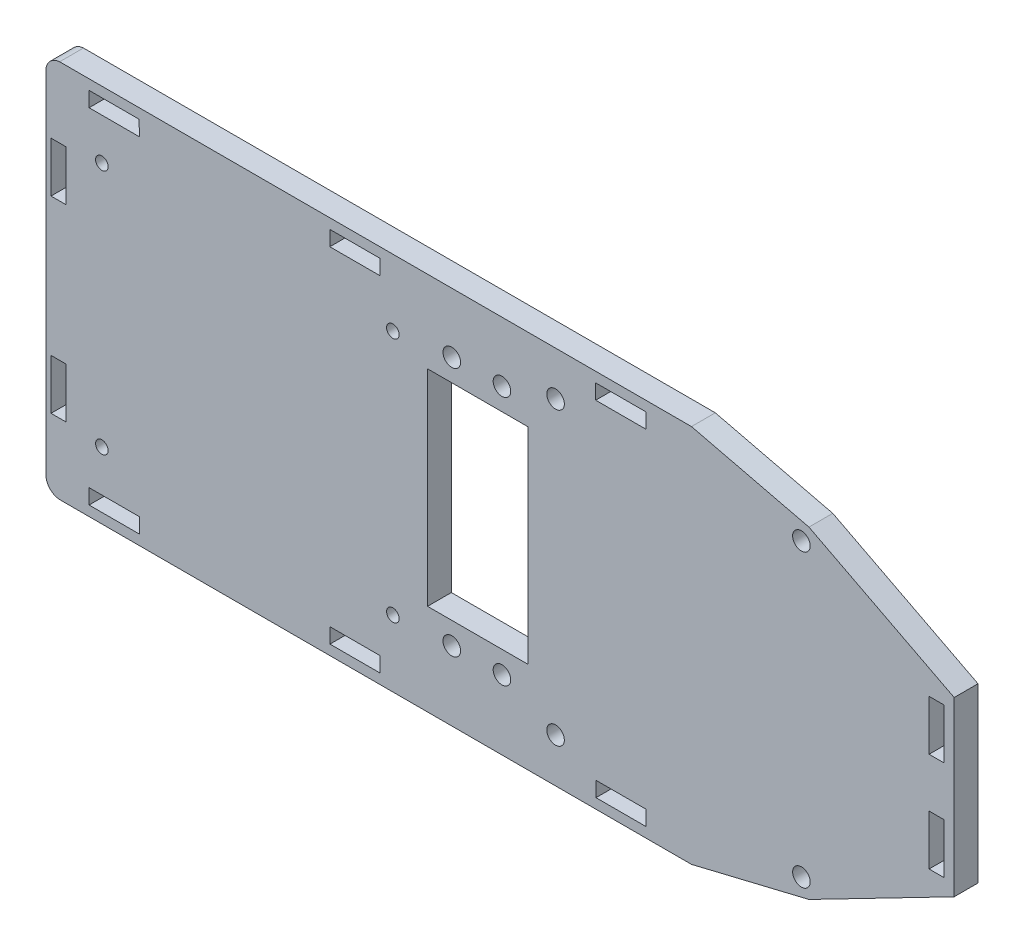
from build123d import *

# Parameters (mm, degrees)
SKETCH1_W           = 181
SKETCH1_H           = 75.57
BOSS_EXTRUDE2_DEPTH = 4.75
SKETCH6_W           = 3
SKETCH6_H           = 10
SKETCH6_W_2         = 10
SKETCH6_H_2         = 2.996296141
SKETCH6_W_3         = 9.939831887
SKETCH6_H_3         = 3
SKETCH6_W_4         = 20
SKETCH6_H_4         = 41
SKETCH6_R           = 1.75
SKETCH6_R_2         = 1.25
CUT_EXTRUDE7_DEPTH  = 9


with BuildPart() as part:
    # Sketch1 → Boss-Extrude2 (new body)
    with BuildSketch(Plane.XY):
        Rectangle(SKETCH1_W, SKETCH1_H)
    extrude(amount=BOSS_EXTRUDE2_DEPTH)

    # Sketch6 → Cut-Extrude7 (cut)
    with BuildSketch(Plane.XY.offset(4.75)):
        with BuildLine():
            Line((-90.5, 37.785), (-90.5, 35.274795088))
            ThreePointArc((-90.5, 35.274795088), (-89.587457665, 37.010103297), (-87.786468161, 37.785))
            Line((-87.786468161, 37.785), (-90.5, 37.785))
        make_face()
        with BuildLine():
            ThreePointArc((-87.786468161, -37.785), (-89.587457665, -37.010103297), (-90.5, -35.274795088))
            Line((-90.5, -35.274795088), (-90.5, -37.785))
            Line((-90.5, -37.785), (-87.786468161, -37.785))
        make_face()
        Polygon((90.5, 37.785), (38.141923512, 37.785), (61.552812751, 32.14), (90.5, 17.2), align=None)
        Polygon((61.552812751, -32.135214744), (38.141923512, -37.785), (90.5, -37.785), (90.5, -17.2), align=None)
        Polygon((-81.947178372, 35.785), (-81.913405317, 32.785953243), (-71.879658735, 32.785762546), (-71.94729523, 35.785), align=None)
        with Locations((-88, 18.75)):
            Rectangle(SKETCH6_W, SKETCH6_H)
        with Locations((-88, -18.75)):
            Rectangle(SKETCH6_W, SKETCH6_H)
        Polygon((-33.930858677, 35.785), (-33.929672617, 32.785000234), (-23.927298062, 32.788706115), (-23.930975535, 35.785), align=None)
        Polygon((-71.879658735, -32.785190697), (-81.913405317, -32.785000001), (-81.913478974, -35.785), (-71.913483982, -35.785), align=None)
        Polygon((-33.903748919, -32.785912448), (-33.902562858, -35.785912214), (-23.88684069, -35.786102825), (-23.88684069, -32.786102825), align=None)
        with Locations((87, 9.9)):
            Rectangle(SKETCH6_W, SKETCH6_H)
        with Locations((24.052991197, 34.28685193)):
            Rectangle(SKETCH6_W_2, SKETCH6_H_2)
        with Locations((24.083075253, -34.285)):
            Rectangle(SKETCH6_W_3, SKETCH6_H_3)
        with Locations((-4.459374015, 0.957016564)):
            Rectangle(SKETCH6_W_4, SKETCH6_H_4)
        with Locations((87, -9.9)):
            Rectangle(SKETCH6_W, SKETCH6_H)
        with Locations((-9.629374015, 25.857016564)):
            Circle(SKETCH6_R)
        with Locations((0.370625985, 25.857016564)):
            Circle(SKETCH6_R)
        with Locations((0.370625985, -23.942983436)):
            Circle(SKETCH6_R)
        with Locations((-9.629374015, -23.942983436)):
            Circle(SKETCH6_R)
        with Locations((11.052985258, -29)):
            Circle(SKETCH6_R)
        with Locations((11.052985258, 29)):
            Circle(SKETCH6_R)
        with Locations((60.052985258, -29)):
            Circle(SKETCH6_R)
        with Locations((60.052985258, 29)):
            Circle(SKETCH6_R)
        with Locations((-79.373192673, 24.5)):
            Circle(SKETCH6_R_2)
        with Locations((-79.373192673, -24.5)):
            Circle(SKETCH6_R_2)
        with Locations((-21.373192673, -24.5)):
            Circle(SKETCH6_R_2)
        with Locations((-21.373192673, 24.5)):
            Circle(SKETCH6_R_2)
    extrude(amount=-CUT_EXTRUDE7_DEPTH, mode=Mode.SUBTRACT)


solid = part.part
